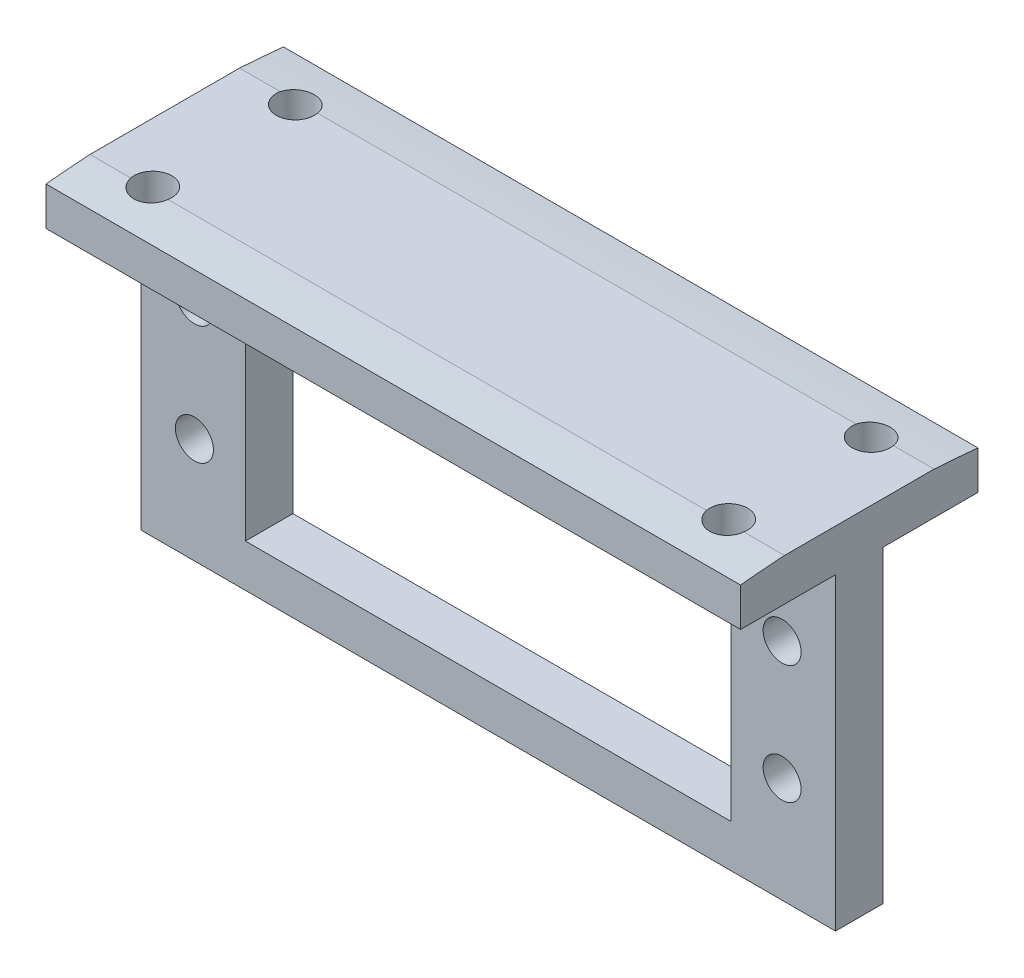
from build123d import *

# Parameters (mm, degrees)
WEB_SKETCH_W               = 58.5
WEB_SKETCH_H               = 26
WEB_DEPTH                  = 2
FLANGE_SKETCH_W            = 58.5
FLANGE_SKETCH_H            = 3.55
FLANGE_DEPTH               = 10
FLANGE_TO_TUBE_SKETCH_W    = 60.5
FLANGE_TO_TUBE_SKETCH_H    = 1.8
SERVO_CUTOUT_SKETCH_W      = 40.9
SERVO_CUTOUT_SKETCH_H      = 20.6
SERVO_CUTOUT_DEPTH         = 3
SERVO_SCREW_HOLES_SKETCH_R = 1.6
SERVO_SCREW_HOLES_DEPTH    = 3
TUBE_SCREW_HOLES_SKETCH_R  = 1.6
TUBE_SCREW_HOLES_DEPTH     = 104.05


with BuildPart() as part:
    # Web Sketch → Web (new, symmetric)
    with BuildSketch(Plane.XY):
        with Locations((-101.1, 82.5)):
            Rectangle(WEB_SKETCH_W, WEB_SKETCH_H)
    extrude(amount=WEB_DEPTH, both=True)

    # Flange Sketch → Flange (add, symmetric)
    with BuildSketch(Plane.XY):
        with Locations((-101.1, 97.275)):
            Rectangle(FLANGE_SKETCH_W, FLANGE_SKETCH_H)
    extrude(amount=FLANGE_DEPTH, both=True)

    # Flange To Tube Sketch → Flange To Tube (revolve, cut)
    with BuildSketch(Plane.XY):
        with Locations((-101.1, 100.15)):
            Rectangle(FLANGE_TO_TUBE_SKETCH_W, FLANGE_TO_TUBE_SKETCH_H)
    revolve(axis=Axis((-180.35, 0, 0), (1, 0, 0)), mode=Mode.SUBTRACT)

    # Servo Cutout Sketch → Servo Cutout (cut, symmetric)
    with BuildSketch(Plane.XY):
        with Locations((-101.1, 83.4)):
            Rectangle(SERVO_CUTOUT_SKETCH_W, SERVO_CUTOUT_SKETCH_H)
    extrude(amount=SERVO_CUTOUT_DEPTH, both=True, mode=Mode.SUBTRACT)

    # Servo Screw Holes Sketch → Servo Screw Holes (cut, symmetric)
    with BuildSketch(Plane.XY):
        with Locations((-125.85, 78.4)):
            Circle(SERVO_SCREW_HOLES_SKETCH_R)
        with Locations((-125.85, 88.4)):
            Circle(SERVO_SCREW_HOLES_SKETCH_R)
        with Locations((-76.35, 78.4)):
            Circle(SERVO_SCREW_HOLES_SKETCH_R)
        with Locations((-76.35, 88.4)):
            Circle(SERVO_SCREW_HOLES_SKETCH_R)
    extrude(amount=SERVO_SCREW_HOLES_DEPTH, both=True, mode=Mode.SUBTRACT)

    # Tube Screw Holes Sketch → Tube Screw Holes (cut, symmetric)
    with BuildSketch(Plane(origin=(0, 0, 0), x_dir=(1, 0, 0), z_dir=(0, 1, 0))):
        with Locations((-125.35, -6)):
            Circle(TUBE_SCREW_HOLES_SKETCH_R)
        with Locations((-125.35, 6)):
            Circle(TUBE_SCREW_HOLES_SKETCH_R)
        with Locations((-76.85, -6)):
            Circle(TUBE_SCREW_HOLES_SKETCH_R)
        with Locations((-76.85, 6)):
            Circle(TUBE_SCREW_HOLES_SKETCH_R)
    extrude(amount=TUBE_SCREW_HOLES_DEPTH, both=True, mode=Mode.SUBTRACT)


solid = part.part
